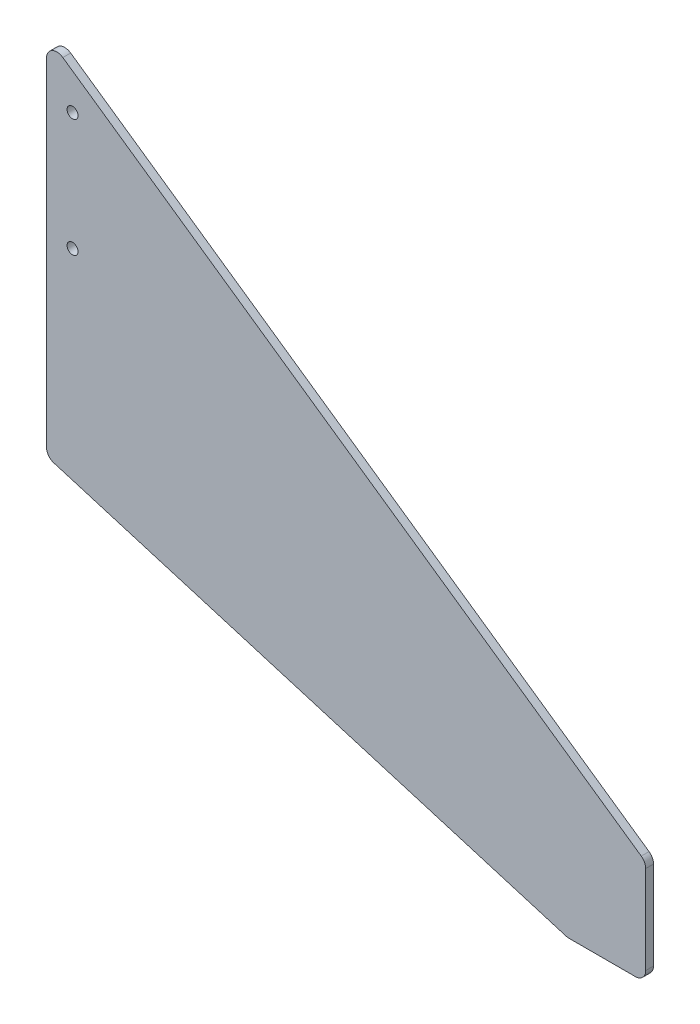
from build123d import *

# Parameters (mm, degrees)
EXTRUDE_1_DEPTH     = 3
SKETCH_2_R          = 2.1
CUT_EXTRUDE_1_DEPTH = 39
FILLET_1_R          = 4


with BuildPart() as part:
    # Эскиз1 → Бобышка-Вытянуть1 (new body)
    with BuildSketch(Plane.XY):
        Polygon((0, 0), (0, 140), (230, -20), (230, -60), (200, -60), align=None)
    extrude(amount=EXTRUDE_1_DEPTH)

    # Эскиз2 → Вырез-Вытянуть1 (cut)
    with BuildSketch(Plane.XY.offset(3)):
        with Locations((10, 74)):
            Circle(SKETCH_2_R)
        with Locations((10, 119.2)):
            Circle(SKETCH_2_R)
    extrude(amount=-CUT_EXTRUDE_1_DEPTH, mode=Mode.SUBTRACT)

    # Скругление1
    fillet_1_edges = [part.edges().sort_by_distance(p)[0] for p in [
        (0, 0, 1.5),
        (0, 140, 1.5),
        (230, -20, 1.5),
        (230, -60, 1.5),
        (200, -60, 1.5),
    ]]
    fillet(fillet_1_edges, radius=FILLET_1_R)


solid = part.part
